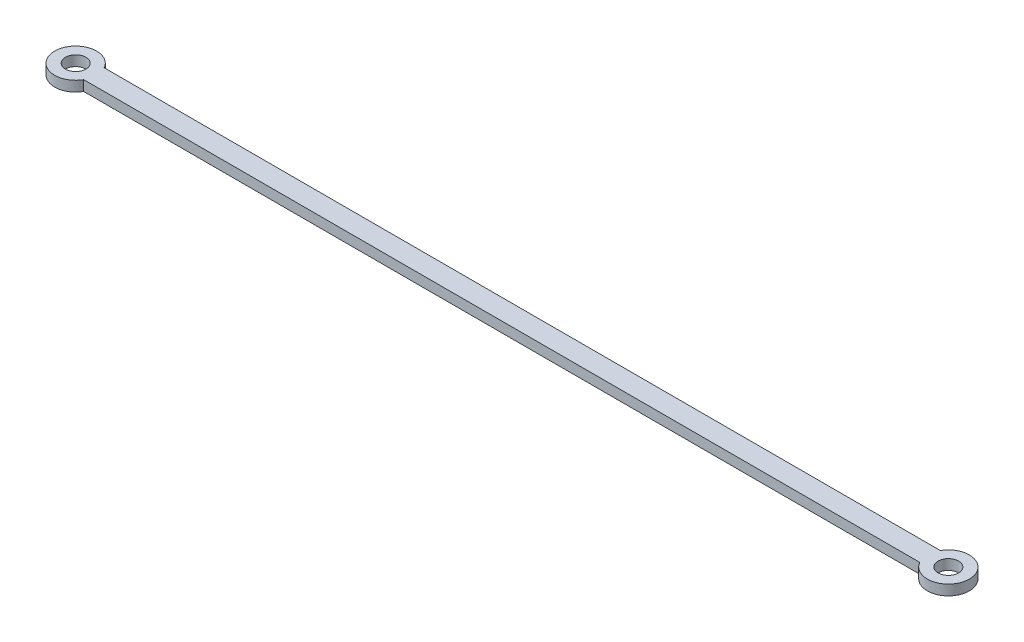
from build123d import *

# Parameters (mm, degrees)
SKETCH4_R           = 40.863144044
SKETCH4_W           = 1629
SKETCH4_H           = 40
BOSS_EXTRUDE1_DEPTH = 20
CUT_EXTRUDE1_REACH  = 894.158
SKETCH6_R           = 20


with BuildPart() as part:
    # Sketch4 → Boss-Extrude1 (new body)
    with BuildSketch(Plane(origin=(0, 0, 0), x_dir=(1, 0, 0), z_dir=(0, 1, 0))):
        with Locations((-850.134204652, 0)):
            Circle(SKETCH4_R)
        with Locations((850.134204652, 0)):
            Circle(SKETCH4_R)
        Rectangle(SKETCH4_W, SKETCH4_H)
    extrude(amount=BOSS_EXTRUDE1_DEPTH)

    # Sketch6 → Cut-Extrude1 (cut, up to next)
    with BuildSketch(Plane.XZ, mode=Mode.PRIVATE) as cut_extrude1_sk1:
        with Locations(Location((-850.134204652, 0, 0), (0, 0, 270))):
            Circle(SKETCH6_R)
    cut_extrude1_tool1 = extrude(cut_extrude1_sk1.sketch, amount=-CUT_EXTRUDE1_REACH, mode=Mode.PRIVATE) & part.part
    # Sketch6 → Cut-Extrude1 (cut, up to next)
    with BuildSketch(Plane.XZ, mode=Mode.PRIVATE) as cut_extrude1_sk2:
        with Locations(Location((850.134204652, 0, 0), (0, 0, 270))):
            Circle(SKETCH6_R)
    cut_extrude1_tool2 = extrude(cut_extrude1_sk2.sketch, amount=-CUT_EXTRUDE1_REACH, mode=Mode.PRIVATE) & part.part
    add(cut_extrude1_tool1.solids().sort_by_distance((-850.134205, 0, 0))[0], mode=Mode.SUBTRACT)
    add(cut_extrude1_tool2.solids().sort_by_distance((850.134205, 0, 0))[0], mode=Mode.SUBTRACT)


solid = part.part
